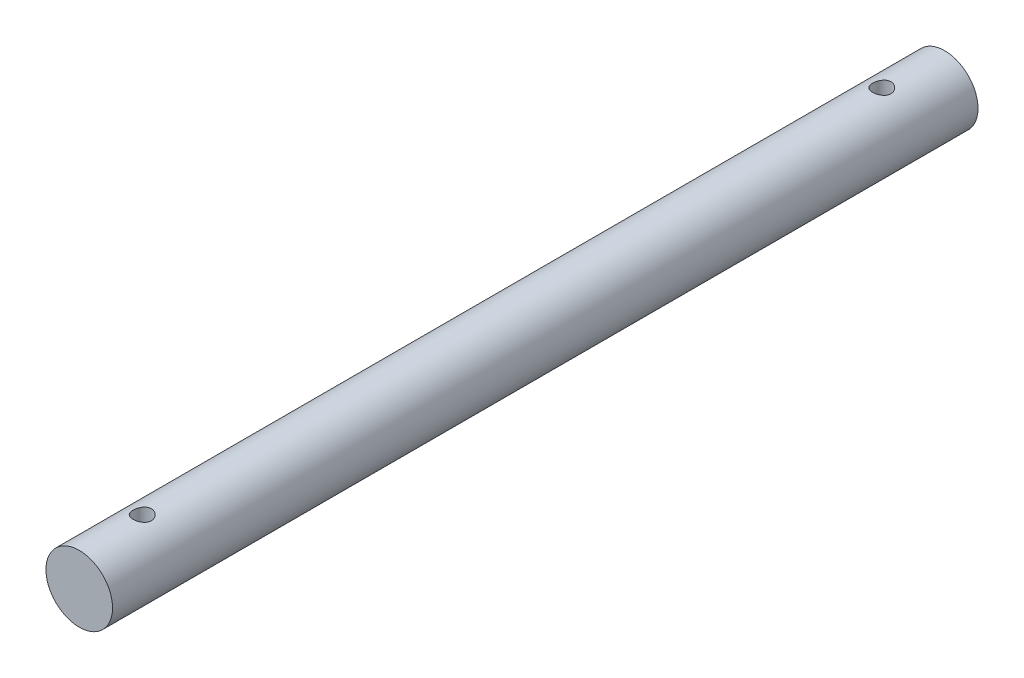
from build123d import *

# Parameters (mm, degrees)
CROQUIS1_R                 = 6.35
SALIENTE_EXTRUIR1_DEPTH    = 165
CORTAR_EXTRUIR1_DEPTH      = 166.244198083
CORTAR_EXTRUIR1_DEPTH_BACK = 166.244198083
CROQUIS2_R                 = 1.75


with BuildPart() as part:
    # Croquis1 → Saliente-Extruir1 (new body)
    with BuildSketch(Plane.XY):
        Circle(CROQUIS1_R)
    extrude(amount=SALIENTE_EXTRUIR1_DEPTH)

    # Croquis2 → Cortar-Extruir1 (cut, two sides: drawn at the far end of the back side and taken through both)
    with BuildSketch(Plane(origin=(0, 0, 0), x_dir=(1, 0, 0), z_dir=(0, 1, 0)).offset(-CORTAR_EXTRUIR1_DEPTH_BACK)):
        with Locations(Location((0, -12, 0), (0, 0, 270))):
            Circle(CROQUIS2_R)
        with Locations(Location((0, -153, 0), (0, 0, 270))):
            Circle(CROQUIS2_R)
    extrude(amount=CORTAR_EXTRUIR1_DEPTH + CORTAR_EXTRUIR1_DEPTH_BACK, mode=Mode.SUBTRACT)


solid = part.part
